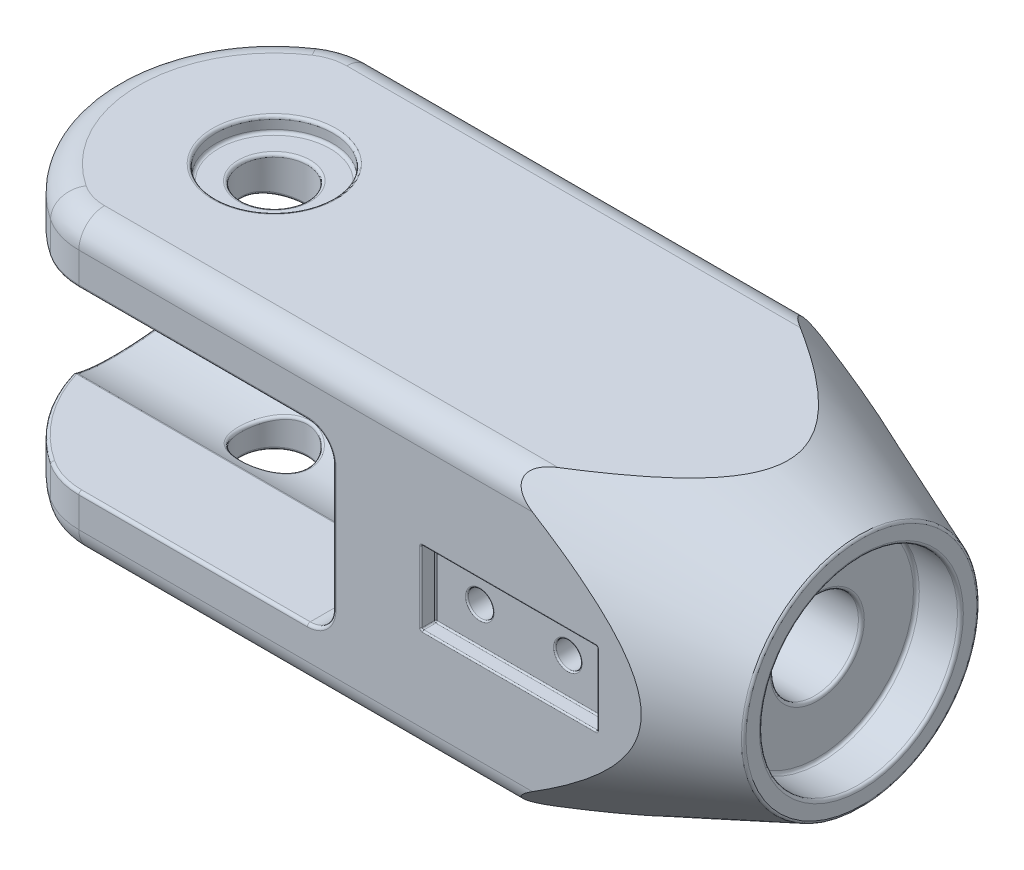
from build123d import *

# Parameters (mm, degrees)
SKETCH1_R               = 2.25
BOSS_EXTRUDE1_DEPTH     = 10
CUT_EXTRUDE1_DEPTH      = 53.92447449
CUT_EXTRUDE1_DEPTH_BACK = 53.92447449
SKETCH2_W               = 25
SKETCH2_H               = 12
FILLET1_R               = 5
FILLET2_R               = 1.75
FILLET3_R               = 1.75
SKETCH4_R               = 3
CUT_EXTRUDE2_DEPTH      = 53.924474527
SKETCH5_R               = 6.75
CUT_EXTRUDE3_DEPTH      = 3
SKETCH6_R               = 6.75
CUT_EXTRUDE4_DEPTH      = 30.597297329
CUT_EXTRUDE5_START      = -4.5
SKETCH7_R               = 6.75
CUT_EXTRUDE5_DEPTH      = 4.5
SKETCH8_R               = 0.875
CUT_EXTRUDE6_DEPTH      = 6
SKETCH9_W               = 12
SKETCH9_H               = 5
CUT_EXTRUDE7_DEPTH      = 1
FILLET4_R               = 0.1
SKETCH10_R              = 4
CUT_EXTRUDE8_DEPTH      = 1
SKETCH11_R              = 5
CUT_EXTRUDE9_DEPTH      = 1.5
FILLET5_R               = 0.2


with BuildPart() as part:
    # Sketch1 → Boss-Extrude1 (new, symmetric)
    with BuildSketch(Plane(origin=(0, 0, 0), x_dir=(1, 0, 0), z_dir=(0, 1, 0))):
        with BuildLine():
            Line((-44.582575695, 10), (0, 10))
            Line((0, 10), (0, -10))
            Line((0, -10), (-44.582575695, -10))
            ThreePointArc((-44.582575695, -10), (-51, 0), (-44.582575695, 10))
        make_face()
        with Locations(Location((-40, 0, 0), (0, 0, 270))):
            Circle(SKETCH1_R, mode=Mode.SUBTRACT)
    extrude(amount=BOSS_EXTRUDE1_DEPTH, both=True)

    # Sketch2 → Cut-Extrude1 (cut, two sides: drawn at the far end of the back side and taken through both)
    with BuildSketch(Plane.XY.offset(-CUT_EXTRUDE1_DEPTH_BACK)):
        with Locations((-38.5, 0)):
            Rectangle(SKETCH2_W, SKETCH2_H)
    extrude(amount=CUT_EXTRUDE1_DEPTH + CUT_EXTRUDE1_DEPTH_BACK, mode=Mode.SUBTRACT)

    # Fillet1
    fillet1_edges = [part.edges().sort_by_distance(p)[0] for p in [
        (-44.582575695, -8, -10),
        (-44.582575695, -8, 10),
        (-44.582575695, 8, -10),
        (-44.582575695, 8, 10),
    ]]
    fillet(fillet1_edges, radius=FILLET1_R)

    # Fillet2
    fillet2_edges = [part.edges().sort_by_distance(p)[0] for p in [
        (-21.658312395, 10, -10),
        (-51, -10, 0),
        (-21.658312395, -10, 10),
        (-44.760000463, -10, 9.787135539),
        (-44.760000463, -10, -9.787135539),
        (-21.658312395, -10, -10),
        (-51, 10, 0),
        (-21.658312395, 10, 10),
        (-44.760000463, 10, 9.787135539),
        (-44.760000463, 10, -9.787135539),
    ]]
    fillet(fillet2_edges, radius=FILLET2_R)

    # Fillet3
    fillet3_edges = [part.edges().sort_by_distance(p)[0] for p in [
        (-26, -6, 0),
        (-26, 6, 0),
    ]]
    fillet(fillet3_edges, radius=FILLET3_R)

    # Sketch3 → Cut-Revolve1 (revolve, cut)
    with BuildSketch(Plane.XY, mode=Mode.PRIVATE) as cut_revolve1_sk:
        Polygon((-15, 14), (0, 14), (0, 8), align=None)
    revolve(cut_revolve1_sk.sketch.rotate(Axis((0, 0, 0), (1, 0, 0)), 90), axis=Axis((0, 0, 0), (1, 0, 0)), mode=Mode.SUBTRACT)

    # Sketch4 → Cut-Extrude2 (cut, through all)
    with BuildSketch(Plane(origin=(0, 0, 0), x_dir=(0, 0, -1), z_dir=(1, 0, 0))):
        Circle(SKETCH4_R)
    extrude(amount=-CUT_EXTRUDE2_DEPTH, mode=Mode.SUBTRACT)

    # Sketch5 → Cut-Extrude3 (cut)
    with BuildSketch(Plane(origin=(0, 0, 0), x_dir=(0, 0, -1), z_dir=(1, 0, 0))):
        Circle(SKETCH5_R)
    extrude(amount=-CUT_EXTRUDE3_DEPTH, mode=Mode.SUBTRACT)

    # Sketch6 → Cut-Extrude4 (cut, through all)
    with BuildSketch(Plane.ZY.offset(26)):
        with Locations(Location((0, 0, 0), (0, 0, 180))):
            Circle(SKETCH6_R)
    extrude(amount=CUT_EXTRUDE4_DEPTH, mode=Mode.SUBTRACT)

    # Sketch7 → Cut-Extrude5 (cut)
    with BuildSketch(Plane.ZY.offset(26).offset(CUT_EXTRUDE5_START)):
        with Locations(Location((0, 0, 0), (0, 0, 180))):
            Circle(SKETCH7_R)
    extrude(amount=CUT_EXTRUDE5_DEPTH, mode=Mode.SUBTRACT)

    # Sketch8 → Cut-Extrude6 (cut)
    with BuildSketch(Plane.XY.offset(10)):
        with Locations((-11, 0)):
            Circle(SKETCH8_R)
        with Locations(Location((-17, 0, 0), (0, 0, 180))):
            Circle(SKETCH8_R)
    extrude(amount=-CUT_EXTRUDE6_DEPTH, mode=Mode.SUBTRACT)

    # Sketch9 → Cut-Extrude7 (cut)
    with BuildSketch(Plane.XY.offset(10)):
        with Locations((-14, 0)):
            Rectangle(SKETCH9_W, SKETCH9_H)
    extrude(amount=-CUT_EXTRUDE7_DEPTH, mode=Mode.SUBTRACT)

    # Fillet4
    fillet4_edges = [part.edges().sort_by_distance(p)[0] for p in [
        (-16.125, 0, 9),
        (-14, -2.5, 10),
        (-8, 0, 10),
        (-14, 2.5, 10),
        (-20, 0, 10),
        (-14, -2.5, 9),
        (-8, -2.5, 9.5),
        (-20, 0, 9),
        (-20, -2.5, 9.5),
        (-14, 2.5, 9),
        (-20, 2.5, 9.5),
        (-8, 0, 9),
        (-8, 2.5, 9.5),
        (-11.875, 0, 9),
    ]]
    fillet(fillet4_edges, radius=FILLET4_R)

    # Sketch10 → Cut-Extrude8 (cut)
    with BuildSketch(Plane(origin=(0, 10, 0), x_dir=(1, 0, 0), z_dir=(0, 1, 0))):
        with Locations(Location((-40, 0, 0), (0, 0, 270))):
            Circle(SKETCH10_R)
    extrude(amount=-CUT_EXTRUDE8_DEPTH, mode=Mode.SUBTRACT)

    # Sketch11 → Cut-Extrude9 (cut)
    with BuildSketch(Plane.XZ.offset(10)):
        with Locations(Location((-40, 0, 0), (0, 0, 270))):
            Circle(SKETCH11_R)
    extrude(amount=-CUT_EXTRUDE9_DEPTH, mode=Mode.SUBTRACT)

    # Fillet5
    fillet5_edges = [part.edges().sort_by_distance(p)[0] for p in [
        (-26, 0, -10),
        (-26, 0, 10),
        (-35.533312395, 6, -10),
        (-35.533312395, 6, 10),
        (-26.512563133, -5.487436867, 10),
        (-26.512563133, -5.487436867, -10),
        (-26.512563133, 5.487436867, 10),
        (-26.512563133, 5.487436867, -10),
        (0, 0, -8),
        (0, 0, 6.75),
        (-3, 0, 6.75),
        (-3, 0, 3),
        (-26.450937147, 5.422576514, -4.019721804),
        (-26.450937147, 5.422576514, 4.019721804),
        (-48.855551697, 6, 6.525274258),
        (-48.855551697, -6, -6.525274258),
        (-40, -6.363961031, -2.25),
        (-39.153198083, -6, 3.092329219),
        (-26.450937149, -5.422576517, 4.019721808),
        (-39.153198083, 6, 3.092329219),
        (-51, 6.75, -1e-09),
        (-51, -6.75, 1e-09),
        (-40, 6.363961031, -2.25),
        (-39.153198083, -6, -3.092329219),
        (-39.153198083, 6, -3.092329219),
        (-26.450937149, -5.422576517, -4.019721808),
        (-26, -2.254462394, -6.362381576),
        (-26, 0, 6.75),
        (-21.5, 0, 6.75),
        (-21.5, 0, 3),
        (-40, 9, -4),
        (-40, 9, -2.25),
        (-40, 10, -4),
        (-40, -8.5, 5),
        (-40, -8.5, -2.25),
        (-40, -10, 5),
        (-48.855551697, -6, 6.525274258),
        (-35.533312395, -6, -10),
        (-35.533312395, -6, 10),
        (-44.760000463, -6, 9.787135539),
        (-44.760000463, -6, -9.787135539),
        (-48.855551697, 6, -6.525274258),
        (-44.760000463, 6, 9.787135539),
        (-44.760000463, 6, -9.787135539),
    ]]
    fillet(fillet5_edges, radius=FILLET5_R)


solid = part.part
